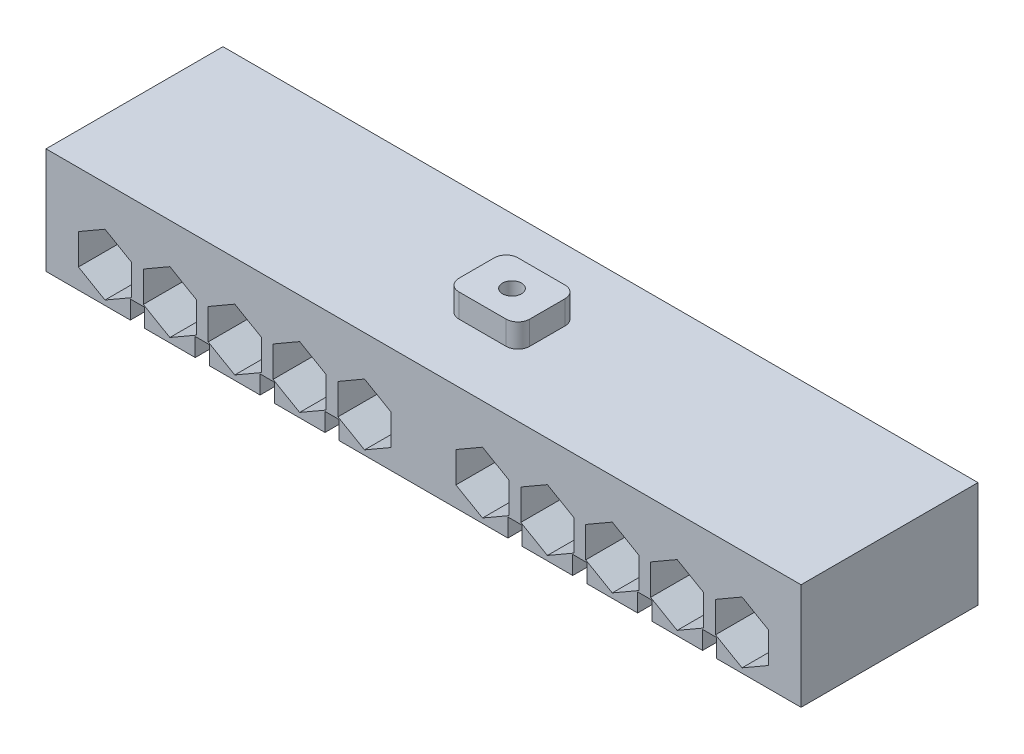
from build123d import *

# Parameters (mm, degrees)
SKETCH1_W           = 64
SKETCH1_H           = 15
BOSS_EXTRUDE1_DEPTH = 9
CUT_EXTRUDE1_DEPTH  = 10
SKETCH3_R           = 2.5
CUT_EXTRUDE2_DEPTH  = 3
SKETCH4_W           = 6
SKETCH4_H           = 5
BOSS_EXTRUDE2_DEPTH = 2
FILLET1_R           = 1
SKETCH9_W           = 1.20235501
SKETCH9_H           = 15
CUT_EXTRUDE3_DEPTH  = 1.55


with BuildPart() as part:
    # Sketch1 → Boss-Extrude1 (new body)
    with BuildSketch(Plane(origin=(0, 0, 0), x_dir=(1, 0, 0), z_dir=(0, 1, 0))):
        Rectangle(SKETCH1_W, SKETCH1_H)
    extrude(amount=BOSS_EXTRUDE1_DEPTH)

    # Sketch2 → Cut-Extrude1 (cut)
    with BuildSketch(Plane.XY.offset(7.5)):
        Polygon((8.24833395, 4.3), (8.24833395, 1.7), (10.5, 0.4), (12.75166605, 1.7), (12.75166605, 4.3), (10.5, 5.6), align=None)
        Polygon((13.74833395, 4.3), (13.74833395, 1.7), (16, 0.4), (18.25166605, 1.7), (18.25166605, 4.3), (16, 5.6), align=None)
        Polygon((19.24833395, 4.3), (19.24833395, 1.7), (21.5, 0.4), (23.75166605, 1.7), (23.75166605, 4.3), (21.5, 5.6), align=None)
        Polygon((24.74833395, 4.3), (24.74833395, 1.7), (27, 0.4), (29.25166605, 1.7), (29.25166605, 4.3), (27, 5.6), align=None)
        Polygon((2.74833395, 4.3), (2.74833395, 1.7), (5, 0.4), (7.25166605, 1.7), (7.25166605, 4.3), (5, 5.6), align=None)
    cut_extrude1 = extrude(amount=-CUT_EXTRUDE1_DEPTH, mode=Mode.SUBTRACT)

    # Mirror1: Cut-Extrude1 across plane
    add(cut_extrude1.mirror(Plane(origin=(0, 0, 0), x_dir=(0, 0, 1), z_dir=(1, 0, 0))), mode=Mode.SUBTRACT)

    # Sketch3 → Cut-Extrude2 (cut)
    with BuildSketch(Plane(origin=(0, 0, -7.5), x_dir=(-1, 0, 0), z_dir=(0, 0, -1))):
        with Locations((-5, 3)):
            Circle(SKETCH3_R)
        with Locations((-10.5, 3)):
            Circle(SKETCH3_R)
        with Locations((-16, 3)):
            Circle(SKETCH3_R)
        with Locations((-21.5, 3)):
            Circle(SKETCH3_R)
        with Locations((-27, 3)):
            Circle(SKETCH3_R)
    cut_extrude2 = extrude(amount=-CUT_EXTRUDE2_DEPTH, mode=Mode.SUBTRACT)

    # Mirror2: Cut-Extrude2 across plane
    add(cut_extrude2.mirror(Plane(origin=(0, 0, 0), x_dir=(0, 0, 1), z_dir=(1, 0, 0))), mode=Mode.SUBTRACT)

    # Sketch4 → Boss-Extrude2 (add)
    with BuildSketch(Plane(origin=(0, 9, 0), x_dir=(1, 0, 0), z_dir=(0, 1, 0))):
        Rectangle(SKETCH4_W, SKETCH4_H)
    extrude(amount=BOSS_EXTRUDE2_DEPTH)

    # Fillet1
    fillet1_edges = [part.edges().sort_by_distance(p)[0] for p in [
        (-3, 10, 2.5),
        (3, 10, 2.5),
        (3, 10, -2.5),
        (-3, 10, -2.5),
    ]]
    fillet(fillet1_edges, radius=FILLET1_R)

    # Sketch7 → M2 Tapped Hole2 (revolve, cut)
    with BuildSketch(Plane(origin=(0, 11, 0), x_dir=(0, 0, 1), z_dir=(1, 0, 0))):
        Polygon((0, 0), (0, 6), (0.8, 5.519311505), (0.8, 0), align=None)
    revolve(axis=Axis((0, 17.35, 0), (0, -1, 0)), mode=Mode.SUBTRACT)

    # Sketch9 → Cut-Extrude3 (cut)
    with BuildSketch(Plane.XZ):
        with Locations((7.75, 0)):
            Rectangle(SKETCH9_W, SKETCH9_H)
        with Locations((13.25, 0)):
            Rectangle(SKETCH9_W, SKETCH9_H)
        with Locations((18.75, 0)):
            Rectangle(SKETCH9_W, SKETCH9_H)
        with Locations((24.25, 0)):
            Rectangle(SKETCH9_W, SKETCH9_H)
    cut_extrude3 = extrude(amount=-CUT_EXTRUDE3_DEPTH, mode=Mode.SUBTRACT)

    # Mirror3: Cut-Extrude3 across plane
    add(cut_extrude3.mirror(Plane(origin=(0, 0, 0), x_dir=(0, 0, 1), z_dir=(1, 0, 0))), mode=Mode.SUBTRACT)


solid = part.part
